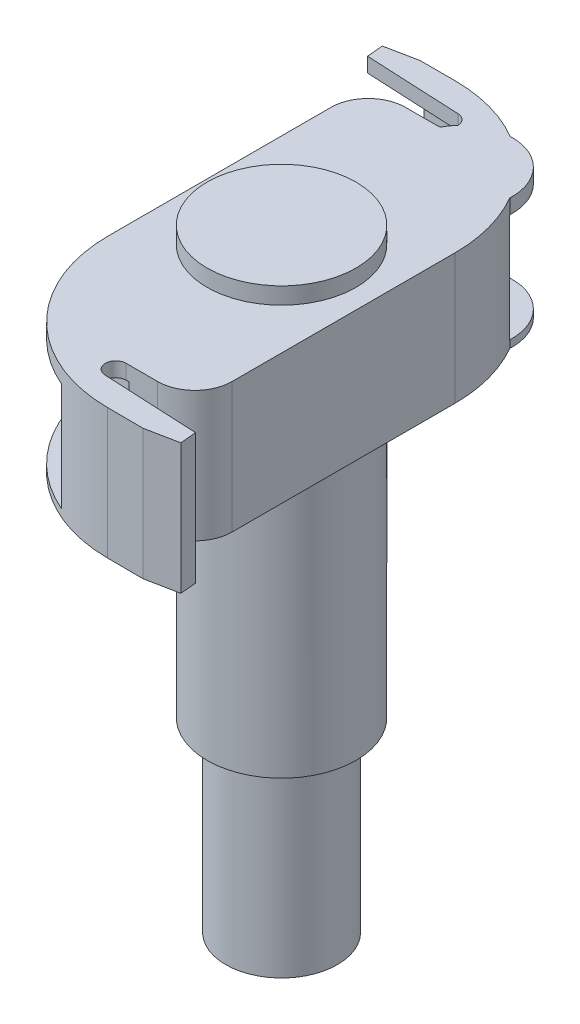
from build123d import *

# Parameters (mm, degrees)
SKETCH1_R           = 1.5
BOSS_EXTRUDE1_DEPTH = 5
SKETCH2_R           = 2
BOSS_EXTRUDE2_DEPTH = 11.45
BOSS_EXTRUDE6_DEPTH = 3.5
SKETCH4_R           = 0.5
BOSS_EXTRUDE5_DEPTH = 3.5
SKETCH5_W           = 3.014329637
SKETCH5_H           = 2.905175639
CUT_EXTRUDE1_DEPTH  = 19.229884569


with BuildPart() as part:
    # Sketch1 → Boss-Extrude1 (new body)
    with BuildSketch(Plane(origin=(0, 0, 0), x_dir=(1, 0, 0), z_dir=(0, 1, 0))):
        with Locations(Location((0, 0, 0), (0, 0, 270))):
            Circle(SKETCH1_R)
    extrude(amount=BOSS_EXTRUDE1_DEPTH)

    # Sketch2 → Boss-Extrude2 (add)
    with BuildSketch(Plane(origin=(0, 5, 0), x_dir=(1, 0, 0), z_dir=(0, 1, 0))):
        with Locations(Location((0, 0, 0), (0, 0, 270))):
            Circle(SKETCH2_R)
    extrude(amount=BOSS_EXTRUDE2_DEPTH)

    # Sketch6 → Boss-Extrude6 (add)
    with BuildSketch(Plane(origin=(0, 12.5, 0), x_dir=(1, 0, 0), z_dir=(0, 1, 0))):
        with BuildLine():
            Line((-2.524010645, -2.130146075), (-2.524010645, 3.851325134))
            ThreePointArc((-2.524010645, 3.851325134), (-2.231117427, 4.558431915), (-1.524010645, 4.851325134))
            Line((-1.524010645, 4.851325134), (-0.668009538, 4.851325134))
            ThreePointArc((-0.668009538, 4.851325134), (-0.399419742, 5.127808451), (-0.664387903, 5.407764478))
            Line((-0.664387903, 5.407764478), (-3.222291114, 5.531885865))
            Line((-3.222291114, 5.531885865), (-3.261907681, 5.966518704))
            Line((-3.261907681, 5.966518704), (-2.412173665, 6.135930219))
            Line((-2.412173665, 6.135930219), (-1.475989355, 6.135930219))
            ThreePointArc((-1.475989355, 6.135930219), (1.35243777, 4.964357344), (2.524010645, 2.135930219))
            Line((2.524010645, 2.135930219), (2.524010645, -3.851325134))
            ThreePointArc((2.524010645, -3.851325134), (2.231117427, -4.558431915), (1.524010645, -4.851325134))
            Line((1.524010645, -4.851325134), (0.668009538, -4.851325134))
            ThreePointArc((0.668009538, -4.851325134), (0.399419742, -5.127808451), (0.664387903, -5.407764478))
            Line((0.664387903, -5.407764478), (3.222291114, -5.531885865))
            Line((3.222291114, -5.531885865), (3.261907681, -5.966518704))
            Line((3.261907681, -5.966518704), (2.412173665, -6.135930219))
            Line((2.412173665, -6.135930219), (1.451593971, -6.130071682))
            ThreePointArc((1.451593971, -6.130071682), (-1.36104973, -4.949934938), (-2.524010645, -2.130146075))
        make_face()
    extrude(amount=BOSS_EXTRUDE6_DEPTH)

    # Sketch4 → Boss-Extrude5 (add)
    with BuildSketch(Plane(origin=(0, 12.5, 0), x_dir=(1, 0, 0), z_dir=(0, 1, 0))):
        with BuildLine():
            Line((0.882439523, -3.95958443), (1.971734047, 4.024950767))
            ThreePointArc((1.971734047, 4.024950767), (0.798204873, 5.569262908), (-0.746107269, 4.395733735))
            Line((-0.746107269, 4.395733735), (-1.835401792, -3.588801462))
            ThreePointArc((-1.835401792, -3.588801462), (-0.661872619, -5.133113604), (0.882439523, -3.95958443))
        make_face()
        with Locations((-0.476481135, -3.774192946)):
            Circle(SKETCH4_R, mode=Mode.SUBTRACT)
        with Locations((0.612813389, 4.210342251)):
            Circle(SKETCH4_R, mode=Mode.SUBTRACT)
    extrude(amount=BOSS_EXTRUDE5_DEPTH)

    # Sketch5 → Cut-Extrude1 (cut, through all)
    with BuildSketch(Plane(origin=(1.396633916, 0, 0.190536536), x_dir=(0.1351734199835011, 0, -0.9908219550100633), z_dir=(0.9908219550100633, 0, 0.1351734199835011))):
        with Locations((-4.25991475, 14.154353636)):
            Rectangle(SKETCH5_W, SKETCH5_H)
        with Locations((4.25991475, 14.154353636)):
            Rectangle(SKETCH5_W, SKETCH5_H)
    extrude(amount=-CUT_EXTRUDE1_DEPTH, mode=Mode.SUBTRACT)


solid = part.part
